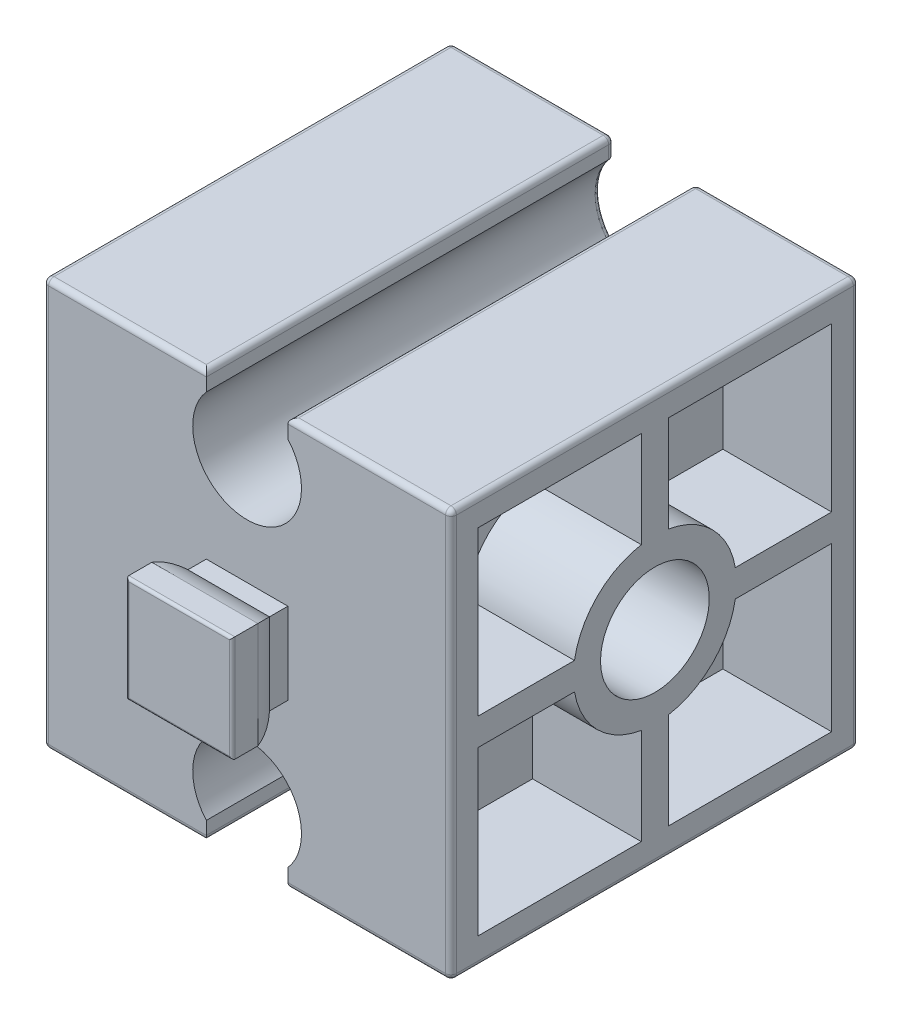
from build123d import *

# Parameters (mm, degrees)
SKETCH_1_W             = 15
SKETCH_1_H             = 15
EXTRUDE_1_DEPTH        = 15
SKETCH_2_W             = 3
SKETCH_2_H             = 3
EXTRUDE_2_DEPTH        = 1
EXTRUDE_3_DEPTH        = 4
CUT_EXTRUDE_1_DEPTH    = 1.95
SKETCH_5_R             = 2
CUT_EXTRUDE_2_DEPTH    = 23.5
CUT_EXTRUDE_3_DEPTH    = 4
CUT_EXTRUDE_START      = -15
CUT_EXTRUDE_4_DEPTH    = 4
CUT_EXTRUDE_5_DEPTH    = 19.371173071
FILLET_1_R             = 0.1
FILLET_2_R             = 0.2
FILLET_1_OF_MIRROR_2_R = 0.1


with BuildPart() as part:
    # 草图1 → 凸台-拉伸1 (new body)
    with BuildSketch(Plane.XY):
        Rectangle(SKETCH_1_W, SKETCH_1_H)
    extrude(amount=-EXTRUDE_1_DEPTH)

    # 草图2 → 凸台-拉伸2 (add)
    with BuildSketch(Plane.XY):
        Rectangle(SKETCH_2_W, SKETCH_2_H)
    extrude_2 = extrude(amount=EXTRUDE_2_DEPTH)

    # 草图5 → 切除-拉伸2 (cut, through all)
    with BuildSketch(Plane.ZY.offset(7.5)):
        with Locations((-7.5, 0)):
            Circle(SKETCH_5_R)
    extrude(amount=-CUT_EXTRUDE_2_DEPTH, mode=Mode.SUBTRACT)

    # 草图6 → 切除-拉伸3 (cut)
    with BuildSketch(Plane.ZY.offset(7.5)):
        with BuildLine():
            Line((-8, 6.5), (-8, 2.958039892))
            ThreePointArc((-8, 2.958039892), (-9.621320344, 2.121320344), (-10.458039892, 0.5))
            Line((-10.458039892, 0.5), (-14, 0.5))
            Line((-14, 0.5), (-14, 6.5))
            Line((-14, 6.5), (-8, 6.5))
        make_face()
        with BuildLine():
            Line((-14, -6.5), (-8, -6.5))
            Line((-8, -6.5), (-8, -2.958039892))
            ThreePointArc((-8, -2.958039892), (-9.621320344, -2.121320344), (-10.458039892, -0.5))
            Line((-10.458039892, -0.5), (-14, -0.5))
            Line((-14, -0.5), (-14, -6.5))
        make_face()
        with BuildLine():
            Line((-1, -6.5), (-1, -0.5))
            Line((-1, -0.5), (-4.541960108, -0.5))
            ThreePointArc((-4.541960108, -0.5), (-5.378679656, -2.121320344), (-7, -2.958039892))
            Line((-7, -2.958039892), (-7, -6.5))
            Line((-7, -6.5), (-1, -6.5))
        make_face()
        with BuildLine():
            Line((-7, 6.5), (-7, 2.958039892))
            ThreePointArc((-7, 2.958039892), (-5.378679656, 2.121320344), (-4.541960108, 0.5))
            Line((-4.541960108, 0.5), (-1, 0.5))
            Line((-1, 0.5), (-1, 6.5))
            Line((-1, 6.5), (-7, 6.5))
        make_face()
    extrude(amount=-CUT_EXTRUDE_3_DEPTH, mode=Mode.SUBTRACT)

    # 草图6<2> → 切除-拉伸4 (cut)
    with BuildSketch(Plane.ZY.offset(7.5).offset(CUT_EXTRUDE_START)):
        with BuildLine():
            Line((-8, 6.5), (-8, 2.958039892))
            ThreePointArc((-8, 2.958039892), (-9.621320344, 2.121320344), (-10.458039892, 0.5))
            Line((-10.458039892, 0.5), (-14, 0.5))
            Line((-14, 0.5), (-14, 6.5))
            Line((-14, 6.5), (-8, 6.5))
        make_face()
        with BuildLine():
            Line((-14, -6.5), (-8, -6.5))
            Line((-8, -6.5), (-8, -2.958039892))
            ThreePointArc((-8, -2.958039892), (-9.621320344, -2.121320344), (-10.458039892, -0.5))
            Line((-10.458039892, -0.5), (-14, -0.5))
            Line((-14, -0.5), (-14, -6.5))
        make_face()
        with BuildLine():
            Line((-1, -6.5), (-1, -0.5))
            Line((-1, -0.5), (-4.541960108, -0.5))
            ThreePointArc((-4.541960108, -0.5), (-5.378679656, -2.121320344), (-7, -2.958039892))
            Line((-7, -2.958039892), (-7, -6.5))
            Line((-7, -6.5), (-1, -6.5))
        make_face()
        with BuildLine():
            Line((-7, 6.5), (-7, 2.958039892))
            ThreePointArc((-7, 2.958039892), (-5.378679656, 2.121320344), (-4.541960108, 0.5))
            Line((-4.541960108, 0.5), (-1, 0.5))
            Line((-1, 0.5), (-1, 6.5))
            Line((-1, 6.5), (-7, 6.5))
        make_face()
    extrude(amount=CUT_EXTRUDE_4_DEPTH, mode=Mode.SUBTRACT)

    # 草图7 → 切除-拉伸5 (cut, through all)
    with BuildSketch(Plane.XY):
        with BuildLine():
            Line((-1.5, -7.5), (-1.5, -6.822875656))
            ThreePointArc((-1.5, -6.822875656), (0, -3.5), (1.5, -6.822875656))
            Line((1.5, -6.822875656), (1.5, -7.5))
            Line((1.5, -7.5), (-1.5, -7.5))
        make_face()
        with BuildLine():
            Line((-1.5, 7.5), (1.5, 7.5))
            Line((1.5, 7.5), (1.5, 6.822875656))
            ThreePointArc((1.5, 6.822875656), (0, 3.5), (-1.5, 6.822875656))
            Line((-1.5, 6.822875656), (-1.5, 7.5))
        make_face()
    extrude(amount=-CUT_EXTRUDE_5_DEPTH, mode=Mode.SUBTRACT)

    # 圆角2
    fillet_2_edges = [part.edges().sort_by_distance(p)[0] for p in [
        (7.5, 0, -15),
        (4.5, 7.5, -15),
        (-4.5, 7.5, -15),
        (-4.5, 7.5, 0),
        (0, 3.5, -15),
        (-1.5, 7.161437828, -15),
        (-1.5, 7.5, -7.5),
        (1.5, 7.161437828, -15),
        (1.5, 7.5, -7.5),
        (4.5, -7.5, -15),
        (4.5, -7.5, 0),
        (1.5, -7.5, -7.5),
        (-1.5, -7.161437828, -15),
        (-1.5, -7.5, -7.5),
        (0, -3.5, -15),
        (1.5, -7.161437828, -15),
        (-7.5, 0, -15),
        (4.5, 7.5, 0),
        (7.5, 0, 0),
        (-4.5, -7.5, 0),
        (-7.5, 0, 0),
        (-4.5, -7.5, -15),
        (-7.5, 7.5, -7.5),
        (7.5, 7.5, -7.5),
        (7.5, -7.5, -7.5),
        (-7.5, -7.5, -7.5),
    ]]
    fillet(fillet_2_edges, radius=FILLET_2_R)


with BuildPart() as body_2:
    # 草图3 → 凸台-拉伸3 (new, symmetric)
    with BuildSketch(Plane(origin=(0, 0, 0), x_dir=(0, 0, -1), z_dir=(1, 0, 0))):
        with BuildLine():
            Line((-2.5, 1.95), (-2.5, -1.95))
            Line((-2.5, -1.95), (-1.555590279, -1.95))
            ThreePointArc((-1.555590279, -1.95), (-1.088161527, -1.780042303), (-0.677124344, -1.5))
            Line((-0.677124344, -1.5), (-0.677124344, 1.5))
            ThreePointArc((-0.677124344, 1.5), (-1.088161527, 1.780042303), (-1.555590279, 1.95))
            Line((-1.555590279, 1.95), (-2.5, 1.95))
        make_face()
    extrude_3 = extrude(amount=EXTRUDE_3_DEPTH, both=True)

    # 草图4 → 切除-拉伸1 (cut, symmetric)
    with BuildSketch(Plane(origin=(0, 0, 0), x_dir=(1, 0, 0), z_dir=(0, 1, 0))):
        with BuildLine():
            Line((-4, -2.5), (-1.95, -2.5))
            Line((-1.95, -2.5), (-1.95, -1.555590279))
            ThreePointArc((-1.95, -1.555590279), (-1.780042303, -1.088161527), (-1.5, -0.677124344))
            Line((-1.5, -0.677124344), (-4, -0.677124344))
            Line((-4, -0.677124344), (-4, -2.5))
        make_face()
        with BuildLine():
            Line((1.95, -2.5), (1.95, -1.555590279))
            ThreePointArc((1.95, -1.555590279), (1.780042303, -1.088161527), (1.5, -0.677124344))
            Line((1.5, -0.677124344), (4, -0.677124344))
            Line((4, -0.677124344), (4, -2.5))
            Line((4, -2.5), (1.95, -2.5))
        make_face()
    cut_extrude_1 = extrude(amount=CUT_EXTRUDE_1_DEPTH, both=True, mode=Mode.SUBTRACT)

    # 圆角1
    fillet_1_edges = [body_2.edges().sort_by_distance(p)[0] for p in [
        (0, 1.95, 2.5),
        (0, -1.95, 2.5),
        (-1.95, 0, 2.5),
        (1.95, 0, 2.5),
    ]]
    fillet(fillet_1_edges, radius=FILLET_1_R)


with BuildPart() as part_1:
    add(part.part)

    # 镜向2: 凸台-拉伸2, 凸台-拉伸3, 切除-拉伸1 across plane
    add(extrude_2.mirror(Plane.XY.offset(-7.5)))
    add(extrude_3.mirror(Plane.XY.offset(-7.5)))
    add(cut_extrude_1.mirror(Plane.XY.offset(-7.5)), mode=Mode.SUBTRACT)

    # 圆角1 of 镜向2
    fillet_1_of_mirror_2_edges = [part_1.edges().sort_by_distance(p)[0] for p in [
        (0, 1.95, -17.5),
        (0, -1.95, -17.5),
        (-1.95, 0, -17.5),
        (1.95, 0, -17.5),
    ]]
    fillet(fillet_1_of_mirror_2_edges, radius=FILLET_1_OF_MIRROR_2_R)


solid = Compound([body_2.part, part_1.part])
